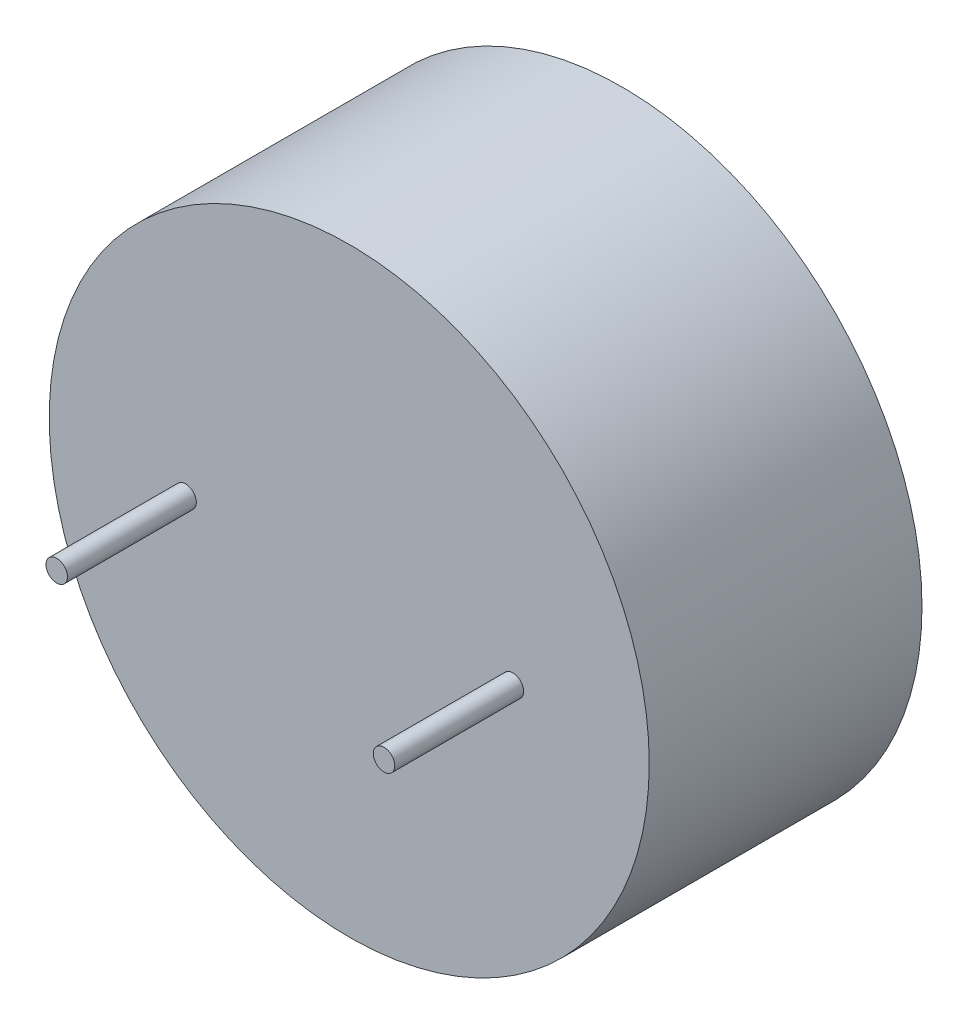
from build123d import *

# Parameters (mm, degrees)
SKETCH1_R           = 13.97
BOSS_EXTRUDE1_DEPTH = 12.7
SKETCH2_R           = 0.499999
SKETCH2_R_2         = 0.5
BOSS_EXTRUDE2_DEPTH = 6


with BuildPart() as part:
    # Sketch1 → Boss-Extrude1 (new body)
    with BuildSketch(Plane.XY):
        Circle(SKETCH1_R)
    extrude(amount=BOSS_EXTRUDE1_DEPTH)

    # Sketch2 → Boss-Extrude2 (add)
    with BuildSketch(Plane.XY.offset(12.7)):
        with Locations((-7.62, 0)):
            Circle(SKETCH2_R)
        with Locations((7.62, 0)):
            Circle(SKETCH2_R_2)
    extrude(amount=BOSS_EXTRUDE2_DEPTH)


solid = part.part
